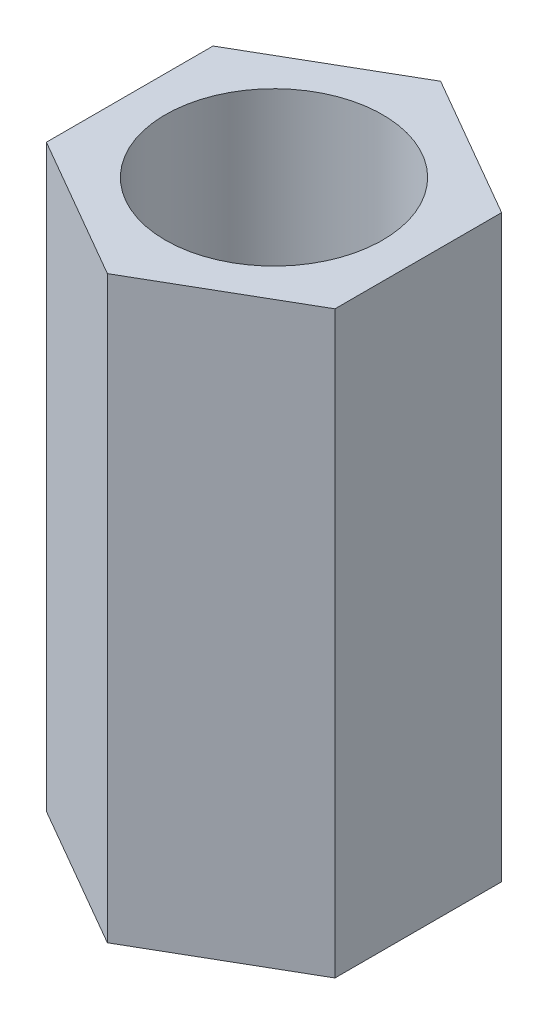
from build123d import *

# Parameters (mm, degrees)
SKETCH_1_R      = 1.5
EXTRUDE_1_DEPTH = 8


with BuildPart() as part:
    # 草图1 → 凸台-拉伸1 (new body)
    with BuildSketch(Plane(origin=(0, 0, 0), x_dir=(1, 0, 0), z_dir=(0, 1, 0))):
        Polygon((1.991858429, 1.15), (0, 2.3), (-1.991858429, 1.15), (-1.991858429, -1.15), (0, -2.3), (1.991858429, -1.15), align=None)
        with Locations(Location((0, 0, 0), (0, 0, 270))):
            Circle(SKETCH_1_R, mode=Mode.SUBTRACT)
    extrude(amount=EXTRUDE_1_DEPTH)


solid = part.part
